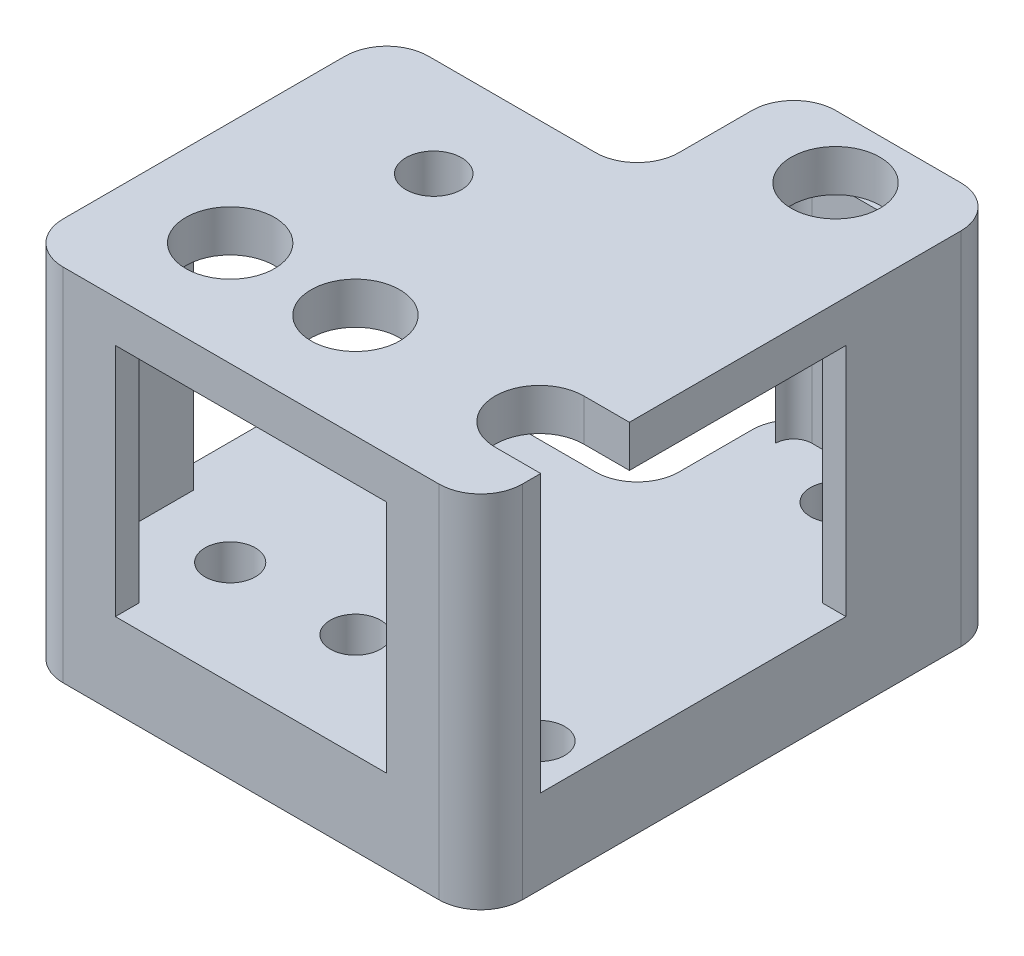
from build123d import *

# Parameters (mm, degrees)
SKETCH1_R           = 2.41215
SKETCH1_R_2         = 2.6605
BOSS_EXTRUDE1_DEPTH = 8
BOSS_EXTRUDE2_DEPTH = 22.5
CUT_EXTRUDE1_DEPTH  = 22.5
SKETCH4_R           = 4.25
SKETCH4_R_2         = 2.6605
BOSS_EXTRUDE3_DEPTH = 4
CUT_EXTRUDE2_REACH  = 77.008
SKETCH6_R           = 10
BOSS_EXTRUDE4_DEPTH = 6
SKETCH7_R           = 2.6605
SKETCH7_W           = 16
SKETCH7_H           = 5
CUT_EXTRUDE3_DEPTH  = 76.00833287
SKETCH8_W           = 20.75
SKETCH8_H           = 22.5
CUT_EXTRUDE4_DEPTH  = 76.00833287
SKETCH9_W           = 26
SKETCH9_H           = 22.5
CUT_EXTRUDE5_DEPTH  = 2.25


with BuildPart() as part:
    # Sketch1 → Boss-Extrude1 (new body)
    with BuildSketch(Plane(origin=(0, 0, 0), x_dir=(1, 0, 0), z_dir=(0, 1, 0))):
        with BuildLine():
            Line((4, 0), (40, 0))
            ThreePointArc((40, 0), (42.828427125, 1.171572875), (44, 4))
            Line((44, 4), (44, 46))
            ThreePointArc((44, 46), (42.828427125, 48.828427125), (40, 50))
            Line((40, 50), (28, 50))
            ThreePointArc((28, 50), (25.171572875, 48.828427125), (24, 46))
            Line((24, 46), (24, 39))
            ThreePointArc((24, 39), (22.828427125, 36.171572875), (20, 35))
            Line((20, 35), (4, 35))
            ThreePointArc((4, 35), (1.171572875, 33.828427125), (0, 31))
            Line((0, 31), (0, 4))
            ThreePointArc((0, 4), (1.171572875, 1.171572875), (4, 0))
        make_face()
        with Locations(Location((34, 44, 0), (0, 0, 270))):
            Circle(SKETCH1_R, mode=Mode.SUBTRACT)
        with Locations(Location((14, 25.5, 0), (0, 0, 270))):
            Circle(SKETCH1_R_2, mode=Mode.SUBTRACT)
        with Locations(Location((10, 10, 0), (0, 0, 270))):
            Circle(SKETCH1_R, mode=Mode.SUBTRACT)
        with Locations(Location((22, 10, 0), (0, 0, 270))):
            Circle(SKETCH1_R, mode=Mode.SUBTRACT)
        with Locations(Location((39.63785, 10, 0), (0, 0, 270))):
            Circle(SKETCH1_R, mode=Mode.SUBTRACT)
    extrude(amount=BOSS_EXTRUDE1_DEPTH)

    # Sketch2 → Boss-Extrude2 (add)
    with BuildSketch(Plane(origin=(0, 8, 0), x_dir=(1, 0, 0), z_dir=(0, 1, 0))):
        with BuildLine():
            Line((4, 35), (20, 35))
            ThreePointArc((20, 35), (22.828427125, 36.171572875), (24, 39))
            Line((24, 39), (24, 46))
            ThreePointArc((24, 46), (25.171572838, 48.828427121), (27.999999942, 50))
            Line((27.999999942, 50), (40, 50))
            ThreePointArc((40, 50), (42.828427125, 48.828427125), (44, 46))
            Line((44, 46), (44, 4))
            ThreePointArc((44, 4), (42.828426987, 1.171572862), (39.999999786, 0))
            Line((39.999999786, 0), (4, 0))
            ThreePointArc((4, 0), (1.171572875, 1.171572875), (0, 4))
            Line((0, 4), (0, 31))
            ThreePointArc((0, 31), (1.171572875, 33.828427125), (4, 35))
        make_face()
        with BuildLine():
            Line((41.75, 46), (41.75, 4.000000214))
            ThreePointArc((41.75, 4.000000214), (41.237436804, 2.762563196), (39.999999786, 2.25))
            Line((39.999999786, 2.25), (4, 2.25))
            ThreePointArc((4, 2.25), (2.762563133, 2.762563133), (2.25, 4))
            Line((2.25, 4), (2.25, 31))
            ThreePointArc((2.25, 31), (2.762563133, 32.237436867), (4, 32.75))
            Line((4, 32.75), (20, 32.75))
            ThreePointArc((20, 32.75), (24.419417382, 34.580582618), (26.25, 39))
            Line((26.25, 39), (26.25, 46.000000058))
            ThreePointArc((26.25, 46.000000058), (26.762563116, 47.237436884), (27.999999942, 47.75))
            Line((27.999999942, 47.75), (40, 47.75))
            ThreePointArc((40, 47.75), (41.237436867, 47.237436867), (41.75, 46))
        make_face(mode=Mode.SUBTRACT)
    extrude(amount=BOSS_EXTRUDE2_DEPTH)

    # Sketch3 → Cut-Extrude1 (cut)
    with BuildSketch(Plane(origin=(0, 30.5, 0), x_dir=(1, 0, 0), z_dir=(0, 1, 0))):
        with BuildLine():
            Line((26.25, 50), (14, 50))
            Line((14, 50), (14, 36.5))
            ThreePointArc((14, 36.5), (6.221825407, 33.278174593), (3, 25.5))
            Line((3, 25.5), (0, 25.5))
            Line((0, 25.5), (0, 14.5))
            Line((0, 14.5), (14, 14.5))
            ThreePointArc((14, 14.5), (21.778174593, 17.721825407), (25, 25.5))
            Line((25, 25.5), (26.25, 25.5))
            Line((26.25, 25.5), (26.25, 50))
        make_face()
    extrude(amount=-CUT_EXTRUDE1_DEPTH, mode=Mode.SUBTRACT)

    # Sketch4 → Boss-Extrude3 (add)
    with BuildSketch(Plane(origin=(0, 30.5, 0), x_dir=(1, 0, 0), z_dir=(0, 1, 0))):
        with BuildLine():
            Line((28, 50), (40, 50))
            ThreePointArc((40, 50), (42.828427125, 48.828427125), (44, 46))
            Line((44, 46), (44, 4))
            ThreePointArc((44, 4), (42.828427125, 1.171572875), (40, 0))
            Line((40, 0), (4, 0))
            ThreePointArc((4, 0), (1.171572875, 1.171572875), (0, 4))
            Line((0, 4), (0, 31))
            ThreePointArc((0, 31), (1.171572875, 33.828427125), (4, 35))
            Line((4, 35), (20, 35))
            ThreePointArc((20, 35), (22.828427125, 36.171572875), (24, 39))
            Line((24, 39), (24, 46))
            ThreePointArc((24, 46), (25.171572875, 48.828427125), (28, 50))
        make_face()
        with Locations(Location((34, 44, 0), (0, 0, 61.927513064))):
            Circle(SKETCH4_R, mode=Mode.SUBTRACT)
        with Locations(Location((14, 25.5, 0), (0, 0, 270))):
            Circle(SKETCH4_R_2, mode=Mode.SUBTRACT)
        with Locations(Location((22, 10, 0), (0, 0, 270))):
            Circle(SKETCH4_R, mode=Mode.SUBTRACT)
        with Locations(Location((10, 10, 0), (0, 0, 270))):
            Circle(SKETCH4_R, mode=Mode.SUBTRACT)
        with Locations(Location((39.63785, 10, 0), (0, 0, 60.199834302))):
            Circle(SKETCH4_R, mode=Mode.SUBTRACT)
    extrude(amount=BOSS_EXTRUDE3_DEPTH)

    # Cut-Extrude2: up to this face of the body (flat: up to its plane)
    cut_extrude2_end = Plane(part.part.faces().sort_by_distance((23.387741141, 8, -22.067767212))[0])
    # Sketch5 → Cut-Extrude2 (cut, up to the picked face)
    with BuildSketch(Plane(origin=(0, 34.5, 0), x_dir=(1, 0, 0), z_dir=(0, 1, 0)), mode=Mode.PRIVATE) as cut_extrude2_sk1:
        with BuildLine():
            Line((39.63785, 14.25), (44, 14.25))
            Line((44, 14.25), (44, 5.75))
            Line((44, 5.75), (39.63785, 5.75))
            ThreePointArc((39.63785, 5.75), (35.38785, 10), (39.63785, 14.25))
        make_face()
    cut_extrude2_tool1 = split(extrude(cut_extrude2_sk1.sketch, amount=-CUT_EXTRUDE2_REACH, mode=Mode.PRIVATE), bisect_by=cut_extrude2_end, keep=Keep.BOTH, mode=Mode.PRIVATE)
    add(cut_extrude2_tool1.solids().sort_by(Axis((40.091525, 34.5, -10), (0, -1, 0)))[0], mode=Mode.SUBTRACT)

    # Sketch6 → Boss-Extrude4 (add)
    with BuildSketch(Plane(origin=(0, 8, 0), x_dir=(1, 0, 0), z_dir=(0, 1, 0))):
        with Locations(Location((14, 25.5, 0), (0, 0, 108.194872339))):
            Circle(SKETCH6_R)
    extrude(amount=BOSS_EXTRUDE4_DEPTH)

    # Sketch7 → Cut-Extrude3 (cut, through all)
    with BuildSketch(Plane.XZ):
        with Locations(Location((14, -25.5, 0), (0, 0, 90))):
            Circle(SKETCH7_R)
        with Locations((12, -37.5)):
            Rectangle(SKETCH7_W, SKETCH7_H)
    extrude(amount=-CUT_EXTRUDE3_DEPTH, mode=Mode.SUBTRACT)

    # Sketch8 → Cut-Extrude4 (cut, through all)
    with BuildSketch(Plane(origin=(44, 0, 0), x_dir=(0, 0, -1), z_dir=(1, 0, 0))):
        with Locations((24.625, 19.25)):
            Rectangle(SKETCH8_W, SKETCH8_H)
    extrude(amount=-CUT_EXTRUDE4_DEPTH, mode=Mode.SUBTRACT)

    # Sketch9 → Cut-Extrude5 (cut)
    with BuildSketch(Plane.XY):
        with Locations((22, 19.25)):
            Rectangle(SKETCH9_W, SKETCH9_H)
    extrude(amount=-CUT_EXTRUDE5_DEPTH, mode=Mode.SUBTRACT)


solid = part.part
